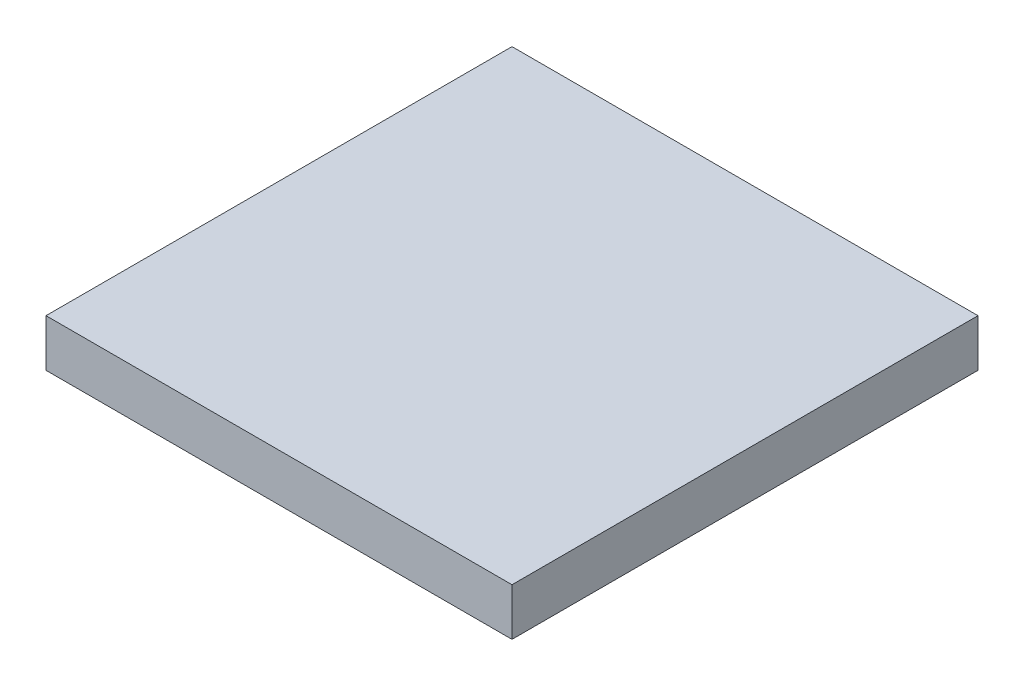
from build123d import *

# Parameters (mm, degrees)
SKETCH2_W           = 250
SKETCH2_H           = 250
BOSS_EXTRUDE1_DEPTH = 25.4


with BuildPart() as part:
    # Sketch2 → Boss-Extrude1 (new body)
    with BuildSketch(Plane(origin=(0, 0, 0), x_dir=(1, 0, 0), z_dir=(0, 1, 0))):
        Rectangle(SKETCH2_W, SKETCH2_H)
    extrude(amount=BOSS_EXTRUDE1_DEPTH)


solid = part.part
